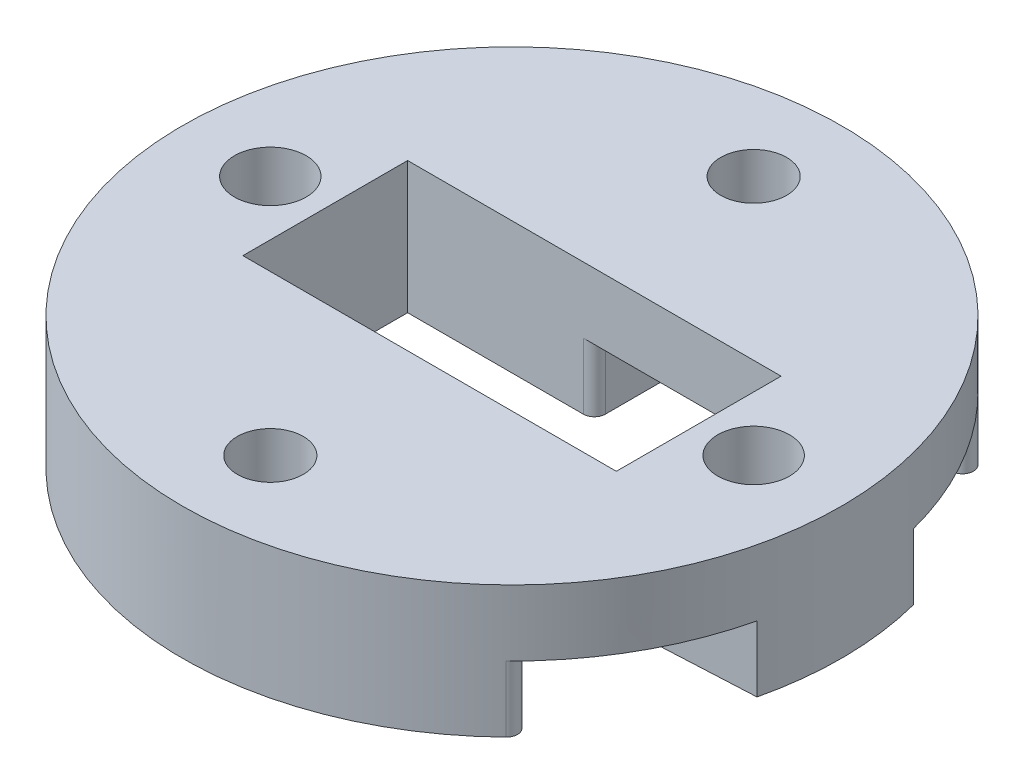
from build123d import *
from build123d.topology import SkipClean

# Parameters (mm, degrees)
SKETCH1_R           = 30
SKETCH1_R_2         = 3.265274059
SKETCH1_R_3         = 3
SKETCH1_W           = 34
SKETCH1_H           = 15
BOSS_EXTRUDE1_DEPTH = 6
BOSS_EXTRUDE3_START = 6
SKETCH3_R           = 3.265274059
BOSS_EXTRUDE3_DEPTH = 6


with BuildPart() as part:
    # Sketch1 → Boss-Extrude1 (new body)
    with BuildSketch(Plane(origin=(0, 0, 0), x_dir=(1, 0, 0), z_dir=(0, 1, 0))):
        with Locations(Location((0, 0, 0), (0, 0, 270))):
            Circle(SKETCH1_R)
        with Locations(Location((-22, 0, 0), (0, 0, 270))):
            Circle(SKETCH1_R_2, mode=Mode.SUBTRACT)
        with Locations(Location((22, 0, 0), (0, 0, 270))):
            Circle(SKETCH1_R_2, mode=Mode.SUBTRACT)
        with Locations(Location((0, 22, 0), (0, 0, 270))):
            Circle(SKETCH1_R_3, mode=Mode.SUBTRACT)
        with Locations(Location((0, -22, 0), (0, 0, 270))):
            Circle(SKETCH1_R_3, mode=Mode.SUBTRACT)
        Rectangle(SKETCH1_W, SKETCH1_H, mode=Mode.SUBTRACT)
    extrude(amount=BOSS_EXTRUDE1_DEPTH)

    # Sketch3 → Boss-Extrude3 (add)
    # profile 1 of 2: a face of its own
    with SkipClean():  # the faces are left unmerged after this step: merging them gives an invalid solid
        with BuildSketch(Plane.XZ.offset(BOSS_EXTRUDE3_START)):
            with BuildLine():
                ThreePointArc((20.95075339, -21.472445888), (21.178609874, -20.379701801), (20.252394943, -19.756697692))
                Line((20.252394943, -19.756697692), (1.991882214, -19.756697692))
                ThreePointArc((1.991882214, -19.756697692), (2.736388737, -20.770294068), (3, -22))
                ThreePointArc((3, -22), (-2.13193129, -24.110656053), (0.030087351, -19.000150879))
                ThreePointArc((0.030087351, -19.000150879), (0.007550342, -18.879350355), (0, -18.756697692))
                Line((0, -18.756697692), (0, -8.5))
                ThreePointArc((0, -8.5), (-0.292893219, -7.792893219), (-1, -7.5))
                Line((-1, -7.5), (-16, -7.5))
                Line((-16, -7.5), (-17, -7.5))
                Line((-17, -7.5), (-17, -6.5))
                Line((-17, -6.5), (-17, 6.5))
                Line((-17, 6.5), (-17, 7.5))
                Line((-17, 7.5), (-16, 7.5))
                Line((-16, 7.5), (-1, 7.5))
                ThreePointArc((-1, 7.5), (-0.292893219, 7.792893219), (0, 8.5))
                Line((0, 8.5), (0, 18.756697692))
                ThreePointArc((0, 18.756697692), (0.007550342, 18.879350355), (0.030087351, 19.000150879))
                ThreePointArc((0.030087351, 19.000150879), (-2.13193129, 24.110656053), (3, 22))
                ThreePointArc((3, 22), (2.736388737, 20.770294068), (1.991882214, 19.756697692))
                Line((1.991882214, 19.756697692), (20.252394943, 19.756697692))
                ThreePointArc((20.252394943, 19.756697692), (21.178609874, 20.379701801), (20.95075339, 21.472445888))
                ThreePointArc((20.95075339, 21.472445888), (-30, 0), (20.95075339, -21.472445888))
            make_face()
            with Locations(Location((-22, 0, 0), (0, 0, 270))):
                Circle(SKETCH3_R, mode=Mode.SUBTRACT)
        # profile 2 of 2: a face of its own
        with BuildSketch(Plane.XZ.offset(BOSS_EXTRUDE3_START)):
            with BuildLine():
                Line((17, -7.5), (29.047375097, -7.5))
                ThreePointArc((29.047375097, -7.5), (29.760890888, -3.780128774), (30, 0))
                ThreePointArc((30, 0), (29.798804579, 3.468608603), (29.197916957, 6.890692662))
                Line((29.197916957, 6.890692662), (17, 7.5))
                Line((17, 7.5), (17, -7.5))
            make_face()
            with Locations(Location((22, 0, 0), (0, 0, 270))):
                Circle(SKETCH3_R, mode=Mode.SUBTRACT)
        extrude(amount=-BOSS_EXTRUDE3_DEPTH)


solid = part.part
